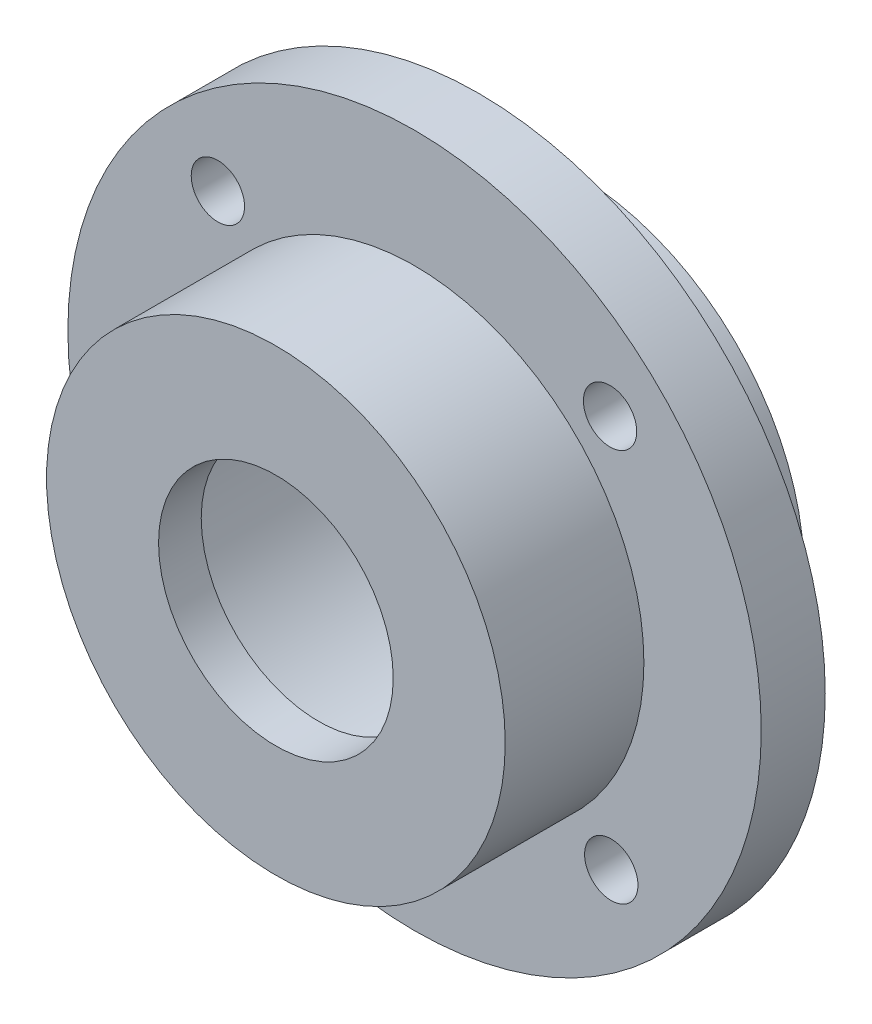
from build123d import *

# Parameters (mm, degrees)
SKETCH_1_R          = 32.5
SKETCH_1_R_2        = 17.5
SKETCH_1_R_3        = 2.5
EXTRUDE_1_DEPTH     = 24
SKETCH_2_R          = 35
SKETCH_2_R_2        = 21.5
CUT_EXTRUDE_2_DEPTH = 9
CUT_EXTRUDE_START   = -9
SKETCH_3_R          = 35
SKETCH_3_R_2        = 21.5
CUT_EXTRUDE_3_DEPTH = 9
EXTRUDE_START       = 4
SKETCH_4_R          = 21.5
SKETCH_4_R_2        = 11
EXTRUDE_4_DEPTH     = 4


with BuildPart() as part:
    # Эскиз1 → Вытянуть1 (new body)
    with BuildSketch(Plane.XY):
        Circle(SKETCH_1_R)
        Circle(SKETCH_1_R_2, mode=Mode.SUBTRACT)
        with Locations((-18.438809137, 18.327731563)):
            Circle(SKETCH_1_R_3, mode=Mode.SUBTRACT)
        with Locations((18.327731563, 18.438809137)):
            Circle(SKETCH_1_R_3, mode=Mode.SUBTRACT)
        with Locations((18.438809137, -18.327731563)):
            Circle(SKETCH_1_R_3, mode=Mode.SUBTRACT)
        with Locations((-18.327731563, -18.438809137)):
            Circle(SKETCH_1_R_3, mode=Mode.SUBTRACT)
    extrude(amount=EXTRUDE_1_DEPTH)

    # Эскиз2 → Вытянуть2 (cut)
    with BuildSketch(Plane.XY.offset(24)):
        Circle(SKETCH_2_R)
        Circle(SKETCH_2_R_2, mode=Mode.SUBTRACT)
    extrude(amount=-CUT_EXTRUDE_2_DEPTH, mode=Mode.SUBTRACT)

    # Эскиз3 → Вытянуть3 (cut)
    with BuildSketch(Plane(origin=(0, 0, 0), x_dir=(-1, 0, 0), z_dir=(0, 0, -1)).offset(CUT_EXTRUDE_START)):
        Circle(SKETCH_3_R)
        with Locations(Location((0, 0, 0), (0, 0, 180))):
            Circle(SKETCH_3_R_2, mode=Mode.SUBTRACT)
    extrude(amount=CUT_EXTRUDE_3_DEPTH, mode=Mode.SUBTRACT)

    # Эскиз4 → Вытянуть4 (add)
    with BuildSketch(Plane.XY.offset(24).offset(EXTRUDE_START)):
        Circle(SKETCH_4_R)
        Circle(SKETCH_4_R_2, mode=Mode.SUBTRACT)
    extrude(amount=-EXTRUDE_4_DEPTH)


solid = part.part
